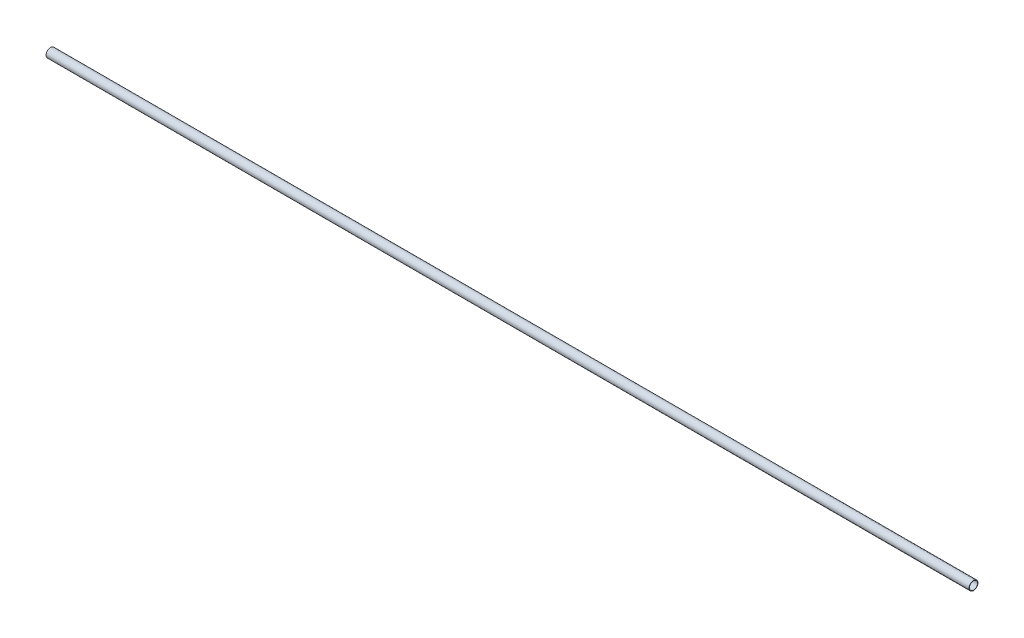
from build123d import *

# Parameters (mm, degrees)
SKETCH3_R           = 14.7701
SKETCH3_R_2         = 13.3223
BOSS_EXTRUDE1_DEPTH = 3048


with BuildPart() as part:
    # Sketch3 → Boss-Extrude1 (new body)
    with BuildSketch(Plane(origin=(0, 0, 0), x_dir=(0, 0, -1), z_dir=(1, 0, 0))):
        Circle(SKETCH3_R)
        Circle(SKETCH3_R_2, mode=Mode.SUBTRACT)
    extrude(amount=BOSS_EXTRUDE1_DEPTH)


solid = part.part
